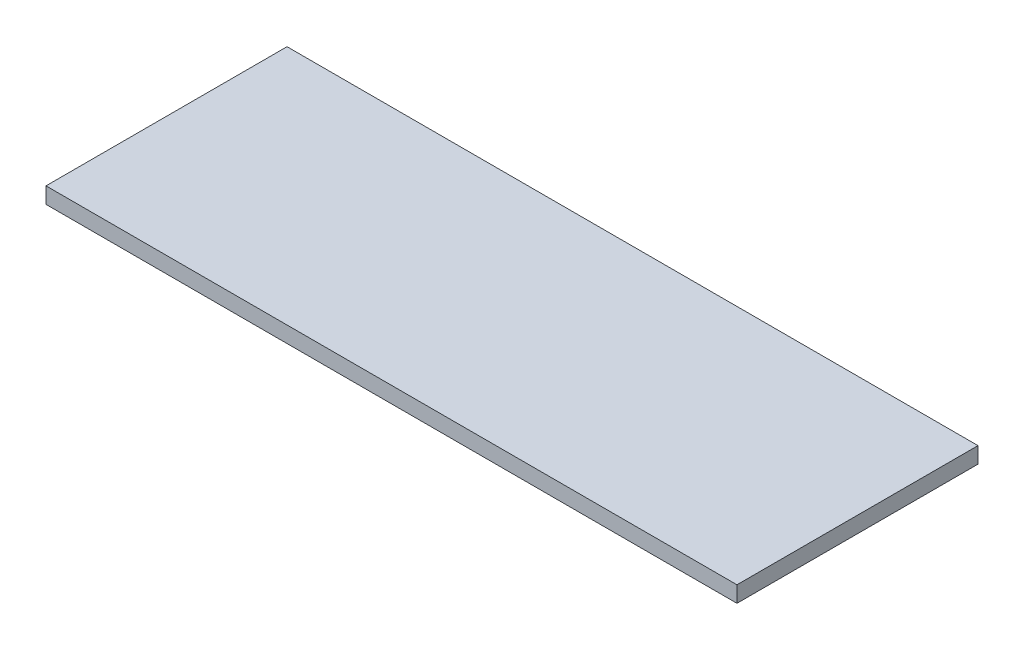
from build123d import *

# Parameters (mm, degrees)
SKETCH1_W           = 430
SKETCH1_H           = 150
BOSS_EXTRUDE1_DEPTH = 10


with BuildPart() as part:
    # Sketch1 → Boss-Extrude1 (new body)
    with BuildSketch(Plane(origin=(0, 0, 0), x_dir=(1, 0, 0), z_dir=(0, 1, 0))):
        Rectangle(SKETCH1_W, SKETCH1_H)
    extrude(amount=BOSS_EXTRUDE1_DEPTH)


solid = part.part
